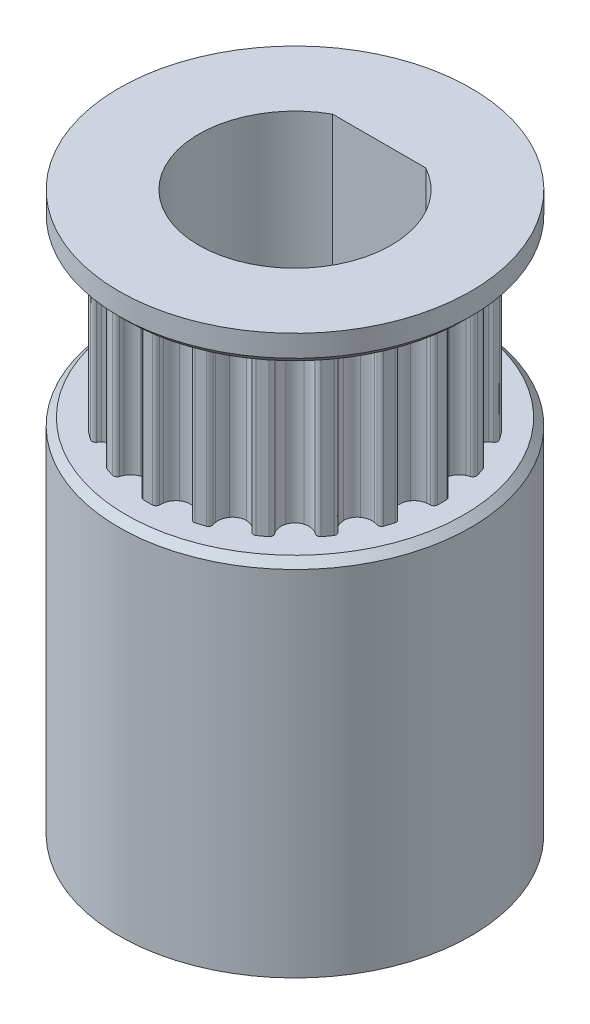
from build123d import *

# Parameters (mm, degrees)
BOSS_EXTRUDE1_DEPTH = 7
SKETCH2_R           = 5.362197724
BOSS_EXTRUDE2_DEPTH = 7
CIRPATTERN3_COUNT   = 20
SKETCH3_R           = 7.312197724
BOSS_EXTRUDE3_DEPTH = 1.2
BOSS_EXTRUDE4_START = 15
SKETCH4_R           = 7.312197724
BOSS_EXTRUDE4_DEPTH = 15
CUT_EXTRUDE1_DEPTH  = 26.400324232
CHAMFER1_SIZE       = 0.3


with BuildPart() as part:
    # Sketch1 → Boss-Extrude1 (new body)
    with BuildSketch(Plane(origin=(0, 0, 0), x_dir=(1, 0, 0), z_dir=(0, 1, 0))):
        with BuildLine():
            ThreePointArc((-0.838832532, 5.296180172), (-0.708843717, 5.333447554), (-0.591725856, 5.401044571))
            ThreePointArc((-0.591725856, 5.401044571), (-0.427411064, 5.584158965), (-0.344526118, 5.815805934))
            ThreePointArc((-0.344526118, 5.815805934), (-0.336322126, 5.887755805), (-0.333346558, 5.960110732))
            ThreePointArc((-0.333346558, 5.960110732), (-0.290777478, 6.064063067), (-0.187961119, 6.109306968))
            ThreePointArc((-0.187961119, 6.109306968), (0, 6.112197724), (0.187961119, 6.109306968))
            ThreePointArc((0.187961119, 6.109306968), (0.290777478, 6.064063067), (0.333346558, 5.960110732))
            ThreePointArc((0.333346558, 5.960110732), (0.336322126, 5.887755805), (0.344526118, 5.815805934))
            ThreePointArc((0.344526118, 5.815805934), (0.427411064, 5.584158965), (0.591725856, 5.401044571))
            ThreePointArc((0.591725856, 5.401044571), (0.708843717, 5.333447554), (0.838832532, 5.296180172))
            ThreePointArc((0.838832532, 5.296180172), (0, 5.362197724), (-0.838832532, 5.296180172))
        make_face()
    boss_extrude1 = extrude(amount=BOSS_EXTRUDE1_DEPTH)

    # Sketch2 → Boss-Extrude2 (add)
    with BuildSketch(Plane.XZ):
        Circle(SKETCH2_R)
        with BuildLine():
            ThreePointArc((-0.838832532, -5.296180172), (-0.708843717, -5.333447554), (-0.591725856, -5.401044571))
            ThreePointArc((-0.591725856, -5.401044571), (-0.427411064, -5.584158965), (-0.344526118, -5.815805934))
            ThreePointArc((-0.344526118, -5.815805934), (-0.336322126, -5.887755805), (-0.333346558, -5.960110732))
            ThreePointArc((-0.333346558, -5.960110732), (-0.290777478, -6.064063067), (-0.187961119, -6.109306968))
            ThreePointArc((-0.187961119, -6.109306968), (0, -6.112197724), (0.187961119, -6.109306968))
            ThreePointArc((0.187961119, -6.109306968), (0.290777478, -6.064063067), (0.333346558, -5.960110732))
            ThreePointArc((0.333346558, -5.960110732), (0.336322126, -5.887755805), (0.344526118, -5.815805934))
            ThreePointArc((0.344526118, -5.815805934), (0.427411064, -5.584158965), (0.591725856, -5.401044571))
            ThreePointArc((0.591725856, -5.401044571), (0.708843717, -5.333447554), (0.838832532, -5.296180172))
            ThreePointArc((0.838832532, -5.296180172), (0, -5.362197724), (-0.838832532, -5.296180172))
        make_face()
    extrude(amount=-BOSS_EXTRUDE2_DEPTH)

    # CirPattern3: Boss-Extrude1 ×20 about axis
    cirpattern3_axis = Axis((0, 0, 0), (0, 1, 0))
    for i in range(1, CIRPATTERN3_COUNT):
        add(boss_extrude1.rotate(cirpattern3_axis, i * 360 / CIRPATTERN3_COUNT))

    # Sketch3 → Boss-Extrude3 (add)
    with BuildSketch(Plane(origin=(0, 7, 0), x_dir=(1, 0, 0), z_dir=(0, 1, 0))):
        with Locations(Location((0, 0, 0), (0, 0, 270))):
            Circle(SKETCH3_R)
    extrude(amount=BOSS_EXTRUDE3_DEPTH)

    # Sketch4 → Boss-Extrude4 (add)
    with BuildSketch(Plane.XZ.offset(BOSS_EXTRUDE4_START)):
        with Locations(Location((0, 0, 0), (0, 0, 90))):
            Circle(SKETCH4_R)
    extrude(amount=-BOSS_EXTRUDE4_DEPTH)

    # Sketch5 → Cut-Extrude1 (cut, through all)
    with BuildSketch(Plane(origin=(0, 8.2, 0), x_dir=(1, 0, 0), z_dir=(0, 1, 0))):
        with BuildLine():
            Line((-1.936491673, 3.5), (1.936491673, 3.5))
            ThreePointArc((1.936491673, 3.5), (0, -4), (-1.936491673, 3.5))
        make_face()
    extrude(amount=-CUT_EXTRUDE1_DEPTH, mode=Mode.SUBTRACT)

    # Chamfer1
    chamfer1_edges = [part.edges().sort_by_distance(p)[0] for p in [
        (0, 7, -7.312197724),
        (0, 0, -7.312197724),
    ]]
    chamfer(chamfer1_edges, length=CHAMFER1_SIZE)


solid = part.part
